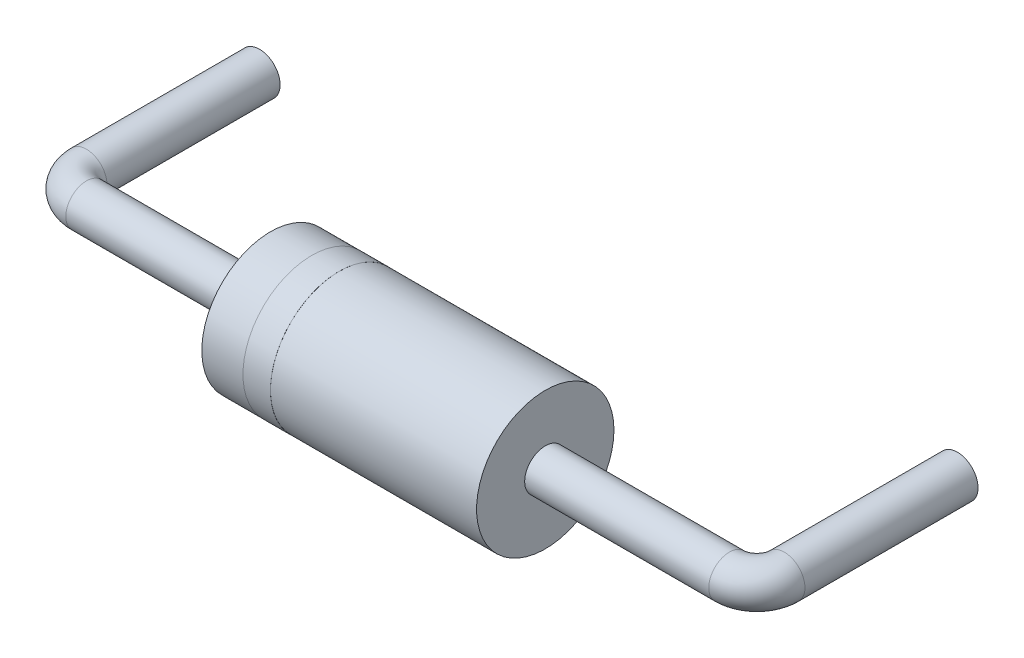
from build123d import *

# Parameters (mm, degrees)
IZIM2_R                     = 0.3
IZIM4_R                     = 1
Y_KSEKLIK_EKSTR_ZYON3_DEPTH = 2
EKSTR_ZYON_NCE1_START       = -1.2
IZIM4_5_R                   = 1.001
IZIM4_5_R_2                 = 1
EKSTR_ZYON_NCE1_DEPTH       = 0.2


with BuildPart() as part:
    # Süpür2: sweep along a path in Çizim3
    with BuildLine(Plane(origin=(0, 0, 0), x_dir=(1, 0, 0), z_dir=(0, 1, 0))) as s_p_r2_path:
        Line((5.08, 2), (5.08, -0.52))
        ThreePointArc((5.08, -0.52), (4.962842712, -0.802842712), (4.68, -0.92))
        Line((4.68, -0.92), (-4.68, -0.92))
        ThreePointArc((-4.68, -0.92), (-4.962842712, -0.802842712), (-5.08, -0.52))
        Line((-5.08, -0.52), (-5.08, 2))
    # Çizim2 → Süpür2 (sweep)
    with BuildSketch(Plane(origin=(0, 0, -2), x_dir=(-1, 0, 0), z_dir=(0, 0, -1))):
        with Locations((-5.08, 0)):
            Circle(IZIM2_R)
    sweep(path=s_p_r2_path.line)

    # Çizim4 → Yükseklik-Ekstrüzyon3 (add, symmetric)
    with BuildSketch(Plane(origin=(0, 0, 0), x_dir=(0, 0, -1), z_dir=(1, 0, 0))):
        with Locations((-0.92, 0)):
            Circle(IZIM4_R)
    extrude(amount=Y_KSEKLIK_EKSTR_ZYON3_DEPTH, both=True)

    # Çizim4<5> → Ekstrüzyon-İnce1 (add, symmetric)
    with BuildSketch(Plane(origin=(0, 0, 0), x_dir=(0, 0, -1), z_dir=(1, 0, 0)).offset(EKSTR_ZYON_NCE1_START)):
        with Locations((-0.92, 0)):
            Circle(IZIM4_5_R)
        with Locations((-0.92, 0)):
            Circle(IZIM4_5_R_2, mode=Mode.SUBTRACT)
    extrude(amount=EKSTR_ZYON_NCE1_DEPTH, both=True)


solid = part.part
